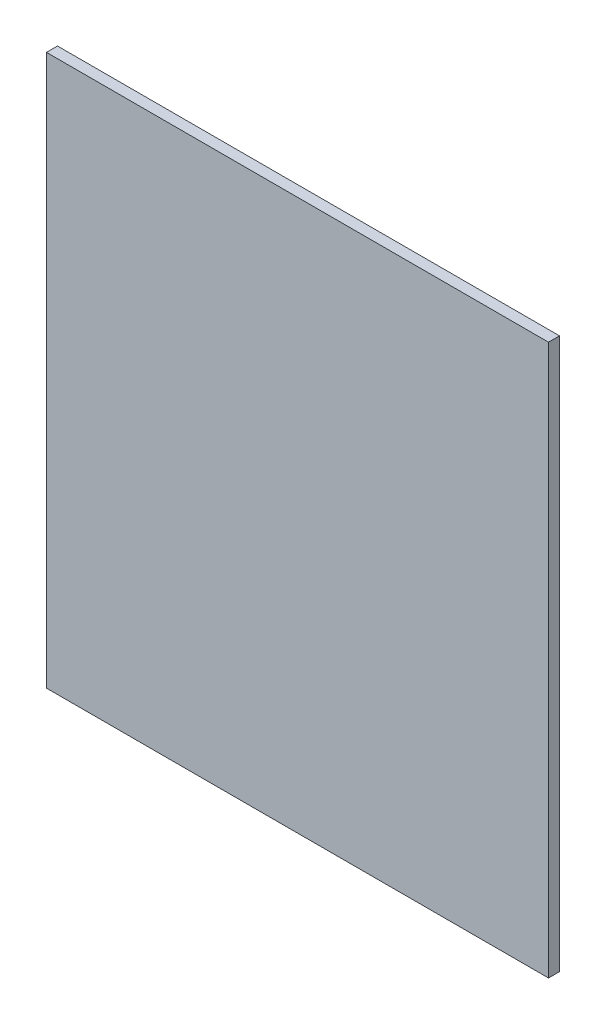
from build123d import *

# Parameters (mm, degrees)
SKETCH1_W           = 136.75
SKETCH1_H           = 150
BOSS_EXTRUDE1_DEPTH = 3


with BuildPart() as part:
    # Sketch1 → Boss-Extrude1 (new body)
    with BuildSketch(Plane.XY):
        Rectangle(SKETCH1_W, SKETCH1_H)
    extrude(amount=BOSS_EXTRUDE1_DEPTH)


solid = part.part
